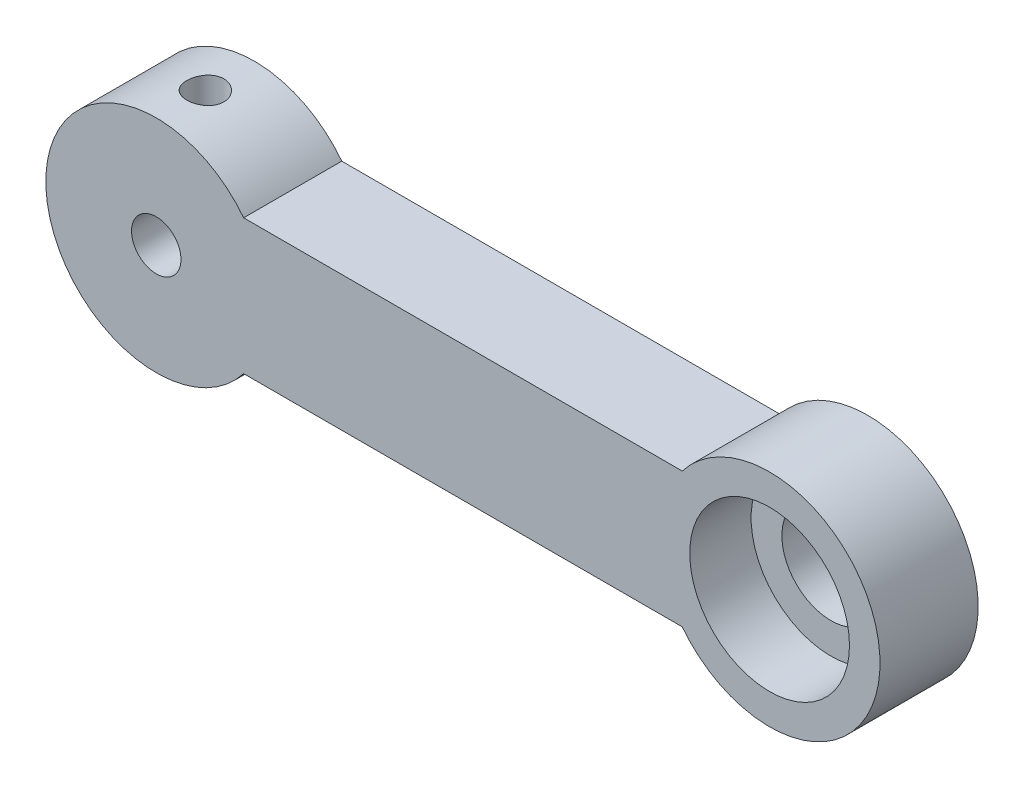
from build123d import *

# Parameters (mm, degrees)
BOSS_EXTRUDE1_DEPTH      = 8
SKETCH3_R                = 4
CUT_EXTRUDE1_DEPTH       = 59.516173282
SKETCH4_R                = 6.51
CUT_EXTRUDE2_DEPTH       = 5
SKETCH12_R               = 9
BOSS_EXTRUDE2_DEPTH      = 8
SKETCH13_R               = 2.015
CUT_EXTRUDE8_DEPTH       = 59.516173282
CUT_EXTRUDE10_DEPTH      = 58.40115448
CUT_EXTRUDE10_DEPTH_BACK = 58.40115448
SKETCH14_R               = 1.51


with BuildPart() as part:
    # Sketch1 → Boss-Extrude1 (new body)
    with BuildSketch(Plane.XY):
        with BuildLine():
            Line((0, 0), (40, 0))
            ThreePointArc((40, 0), (56.123903424, 5.5), (40, 11))
            Line((40, 11), (0, 11))
            Line((0, 11), (0, 0))
        make_face()
    extrude(amount=BOSS_EXTRUDE1_DEPTH)

    # Sketch3 → Cut-Extrude1 (cut, through all)
    with BuildSketch(Plane.XY.offset(8)):
        with Locations((47.123903424, 5.5)):
            Circle(SKETCH3_R)
    extrude(amount=-CUT_EXTRUDE1_DEPTH, mode=Mode.SUBTRACT)

    # Sketch4 → Cut-Extrude2 (cut)
    with BuildSketch(Plane.XY.offset(8)):
        with Locations((47.123903424, 5.5)):
            Circle(SKETCH4_R)
    extrude(amount=-CUT_EXTRUDE2_DEPTH, mode=Mode.SUBTRACT)

    # Sketch12 → Boss-Extrude2 (add)
    with BuildSketch(Plane.XY.offset(8)):
        with Locations((-2.876096576, 5.5)):
            Circle(SKETCH12_R)
    extrude(amount=-BOSS_EXTRUDE2_DEPTH)

    # Sketch13 → Cut-Extrude8 (cut, through all)
    with BuildSketch(Plane.XY.offset(8)):
        with Locations((-2.876096576, 5.5)):
            Circle(SKETCH13_R)
    extrude(amount=-CUT_EXTRUDE8_DEPTH, mode=Mode.SUBTRACT)

    # Sketch14 → Cut-Extrude10 (cut, two sides: drawn at the far end of the back side and taken through both)
    with BuildSketch(Plane(origin=(0, 5.5, 0), x_dir=(1, 0, 0), z_dir=(0, 1, 0)).offset(-CUT_EXTRUDE10_DEPTH_BACK)):
        with Locations(Location((-2.876096576, -4, 0), (0, 0, 270))):
            Circle(SKETCH14_R)
    extrude(amount=CUT_EXTRUDE10_DEPTH + CUT_EXTRUDE10_DEPTH_BACK, mode=Mode.SUBTRACT)


solid = part.part
